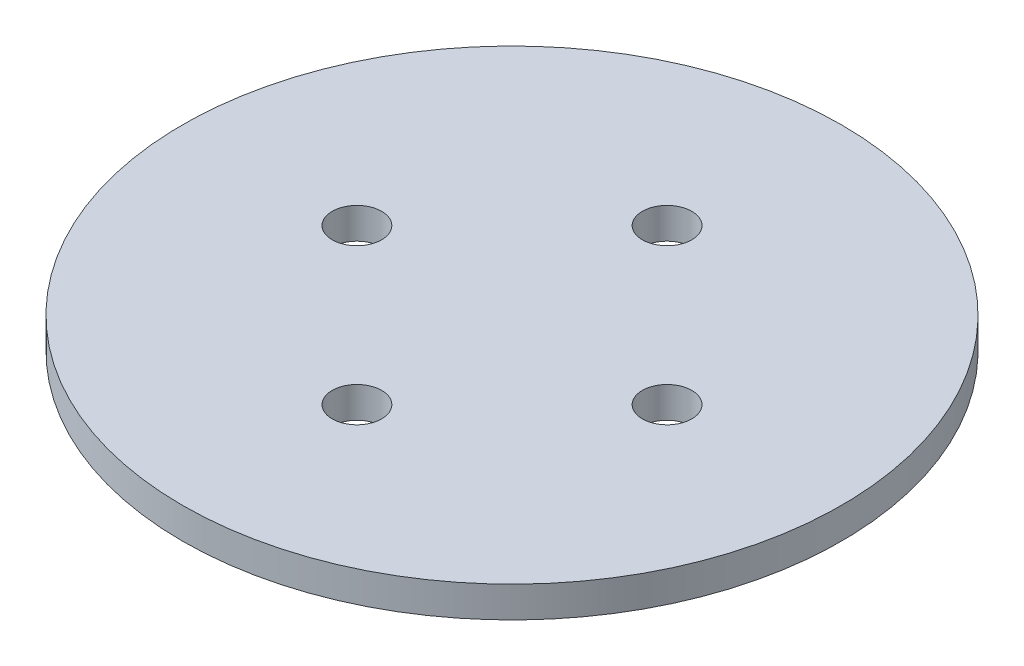
from build123d import *

# Parameters (mm, degrees)
SKETCH_1_R          = 17
EXTRUDE_1_DEPTH     = 1.6
SKETCH_2_R          = 1.275
CUT_EXTRUDE_1_DEPTH = 25.09481272


with BuildPart() as part:
    # 草图1 → 凸台-拉伸1 (new body)
    with BuildSketch(Plane(origin=(0, 0, 0), x_dir=(1, 0, 0), z_dir=(0, 1, 0))):
        with Locations(Location((0, 0, 0), (0, 0, 270))):
            Circle(SKETCH_1_R)
    extrude(amount=EXTRUDE_1_DEPTH)

    # 草图2 → 切除-拉伸1 (cut, through all)
    with BuildSketch(Plane(origin=(0, 1.6, 0), x_dir=(1, 0, 0), z_dir=(0, 1, 0))):
        with Locations(Location((8, 0, 0), (0, 0, 270))):
            Circle(SKETCH_2_R)
        with Locations(Location((0, -8, 0), (0, 0, 270))):
            Circle(SKETCH_2_R)
        with Locations(Location((-8, 0, 0), (0, 0, 270))):
            Circle(SKETCH_2_R)
        with Locations(Location((0, 8, 0), (0, 0, 270))):
            Circle(SKETCH_2_R)
    extrude(amount=-CUT_EXTRUDE_1_DEPTH, mode=Mode.SUBTRACT)


solid = part.part
